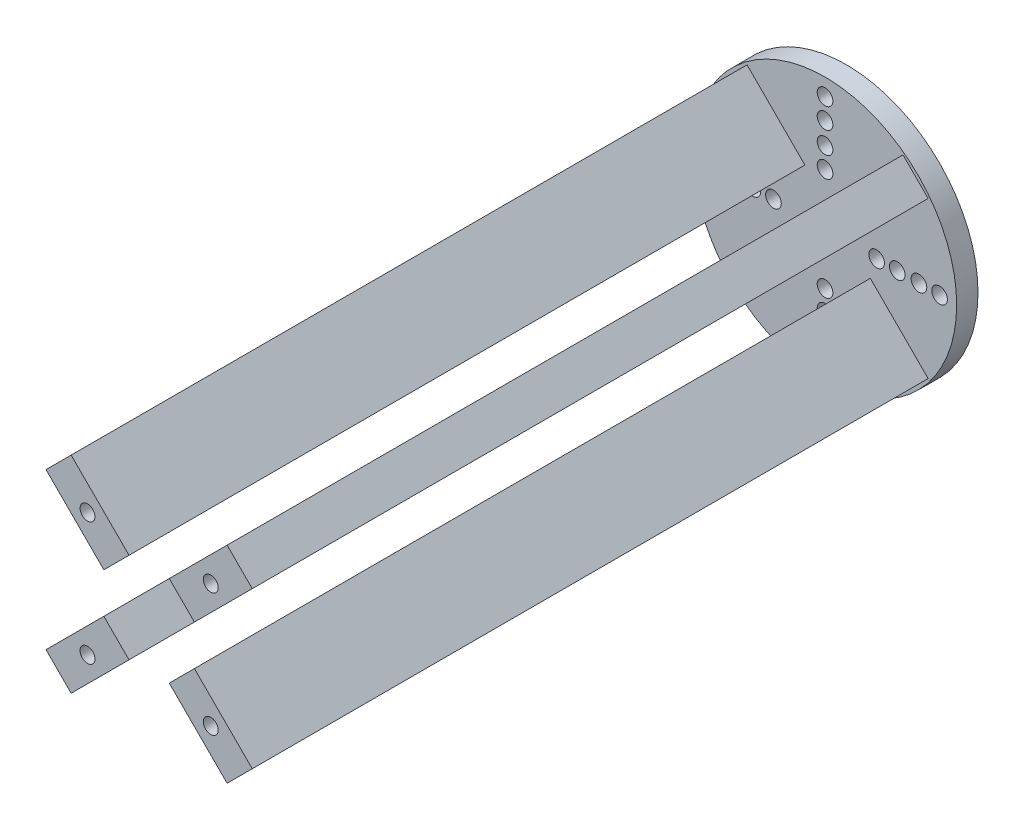
from build123d import *

# Parameters (mm, degrees)
AUFSATZ_LINEAR_AUSTRAGEN1_DEPTH = 3
AUFSATZ_LINEAR_AUSTRAGEN2_DEPTH = 95
SKIZZE5_R                       = 1.05
SCHNITT_LINEAR_AUSTRAGEN2_DEPTH = 13


with BuildPart() as part:
    # Skizze2 → Aufsatz-Linear austragen1 (new body)
    with BuildSketch(Plane.XY):
        with BuildLine():
            ThreePointArc((18.5, 0), (13.081475452, 13.081475452), (0, 18.5))
            Line((0, 18.5), (0, 17.2))
            ThreePointArc((0, 17.2), (0.777817459, 16.877817459), (1.1, 16.1))
            ThreePointArc((1.1, 16.1), (1.099839478, 16.081208438), (1.099357959, 16.06242236))
            ThreePointArc((1.099357959, 16.06242236), (0.764416312, 15.309008406), (0, 15))
            Line((0, 15), (0, 14.3))
            ThreePointArc((0, 14.3), (0.777817459, 13.977817459), (1.1, 13.2))
            ThreePointArc((1.1, 13.2), (1.099761155, 13.177078356), (1.099044724, 13.154166667))
            ThreePointArc((1.099044724, 13.154166667), (0.761440521, 12.40614338), (0, 12.1))
            Line((0, 12.1), (0, 11.25))
            ThreePointArc((0, 11.25), (0.777817459, 10.927817459), (1.1, 10.15))
            ThreePointArc((1.1, 10.15), (1.099595894, 10.120186092), (1.098383874, 10.090394089))
            ThreePointArc((1.098383874, 10.090394089), (0.756450097, 9.35138667), (0, 9.05))
            Line((0, 9.05), (0, 8.35))
            ThreePointArc((0, 8.35), (0.777817459, 8.027817459), (1.1, 7.25))
            ThreePointArc((1.1, 7.25), (1.099207253, 7.208245771), (1.096830153, 7.166551724))
            ThreePointArc((1.096830153, 7.166551724), (0.747732204, 6.443218399), (0, 6.15))
            Line((0, 6.15), (0, 0))
            Line((0, 0), (6.15, 0))
            ThreePointArc((6.15, 0), (6.443218399, 0.747732204), (7.166551724, 1.096830153))
            ThreePointArc((7.166551724, 1.096830153), (7.997732204, 0.806781601), (8.35, 0))
            Line((8.35, 0), (9.05, 0))
            ThreePointArc((9.05, 0), (9.35138667, 0.756450097), (10.090394089, 1.098383874))
            ThreePointArc((10.090394089, 1.098383874), (10.906450097, 0.79861333), (11.25, 0))
            Line((11.25, 0), (12.1, 0))
            ThreePointArc((12.1, 0), (12.40614338, 0.761440521), (13.154166667, 1.099044724))
            ThreePointArc((13.154166667, 1.099044724), (13.961440521, 0.79385662), (14.3, 0))
            Line((14.3, 0), (15, 0))
            ThreePointArc((15, 0), (15.309008406, 0.764416312), (16.06242236, 1.099357959))
            ThreePointArc((16.06242236, 1.099357959), (16.864416312, 0.790991594), (17.2, 0))
            Line((17.2, 0), (18.5, 0))
        make_face()
        with BuildLine():
            ThreePointArc((0, -18.5), (13.081475452, -13.081475452), (18.5, 0))
            Line((18.5, 0), (17.2, 0))
            ThreePointArc((17.2, 0), (16.864416312, -0.790991594), (16.06242236, -1.099357959))
            ThreePointArc((16.06242236, -1.099357959), (15.309008406, -0.764416312), (15, 0))
            Line((15, 0), (14.3, 0))
            ThreePointArc((14.3, 0), (13.961440521, -0.79385662), (13.154166667, -1.099044724))
            ThreePointArc((13.154166667, -1.099044724), (12.40614338, -0.761440521), (12.1, 0))
            Line((12.1, 0), (11.25, 0))
            ThreePointArc((11.25, 0), (10.906450097, -0.79861333), (10.090394089, -1.098383874))
            ThreePointArc((10.090394089, -1.098383874), (9.35138667, -0.756450097), (9.05, 0))
            Line((9.05, 0), (8.35, 0))
            ThreePointArc((8.35, 0), (7.997732204, -0.806781601), (7.166551724, -1.096830153))
            ThreePointArc((7.166551724, -1.096830153), (6.443218399, -0.747732204), (6.15, 0))
            Line((6.15, 0), (0, 0))
            Line((0, 0), (0, -6.15))
            ThreePointArc((0, -6.15), (0.747732204, -6.443218399), (1.096830153, -7.166551724))
            ThreePointArc((1.096830153, -7.166551724), (1.099207253, -7.208245771), (1.1, -7.25))
            ThreePointArc((1.1, -7.25), (0.777817459, -8.027817459), (0, -8.35))
            Line((0, -8.35), (0, -9.05))
            ThreePointArc((0, -9.05), (0.756450097, -9.35138667), (1.098383874, -10.090394089))
            ThreePointArc((1.098383874, -10.090394089), (1.099595894, -10.120186092), (1.1, -10.15))
            ThreePointArc((1.1, -10.15), (0.777817459, -10.927817459), (0, -11.25))
            Line((0, -11.25), (0, -12.1))
            ThreePointArc((0, -12.1), (0.761440521, -12.40614338), (1.099044724, -13.154166667))
            ThreePointArc((1.099044724, -13.154166667), (1.099761155, -13.177078356), (1.1, -13.2))
            ThreePointArc((1.1, -13.2), (0.777817459, -13.977817459), (0, -14.3))
            Line((0, -14.3), (0, -15))
            ThreePointArc((0, -15), (0.764416312, -15.309008406), (1.099357959, -16.06242236))
            ThreePointArc((1.099357959, -16.06242236), (1.099839478, -16.081208438), (1.1, -16.1))
            ThreePointArc((1.1, -16.1), (0.777817459, -16.877817459), (0, -17.2))
            Line((0, -17.2), (0, -18.5))
        make_face()
        with BuildLine():
            Line((-17.2, 0), (-18.5, 0))
            ThreePointArc((-18.5, 0), (-13.081475452, -13.081475452), (0, -18.5))
            Line((0, -18.5), (0, -17.2))
            ThreePointArc((0, -17.2), (-0.790991594, -16.864416312), (-1.099357959, -16.06242236))
            ThreePointArc((-1.099357959, -16.06242236), (-0.764416312, -15.309008406), (0, -15))
            Line((0, -15), (0, -14.3))
            ThreePointArc((0, -14.3), (-0.79385662, -13.961440521), (-1.099044724, -13.154166667))
            ThreePointArc((-1.099044724, -13.154166667), (-0.761440521, -12.40614338), (0, -12.1))
            Line((0, -12.1), (0, -11.25))
            ThreePointArc((0, -11.25), (-0.79861333, -10.906450097), (-1.098383874, -10.090394089))
            ThreePointArc((-1.098383874, -10.090394089), (-0.756450097, -9.35138667), (0, -9.05))
            Line((0, -9.05), (0, -8.35))
            ThreePointArc((0, -8.35), (-0.806781601, -7.997732204), (-1.096830153, -7.166551724))
            ThreePointArc((-1.096830153, -7.166551724), (-0.747732204, -6.443218399), (0, -6.15))
            Line((0, -6.15), (0, 0))
            Line((0, 0), (-6.15, 0))
            ThreePointArc((-6.15, 0), (-6.443218399, -0.747732204), (-7.166551724, -1.096830153))
            ThreePointArc((-7.166551724, -1.096830153), (-7.997732204, -0.806781601), (-8.35, 0))
            Line((-8.35, 0), (-9.05, 0))
            ThreePointArc((-9.05, 0), (-9.35138667, -0.756450097), (-10.090394089, -1.098383874))
            ThreePointArc((-10.090394089, -1.098383874), (-10.906450097, -0.79861333), (-11.25, 0))
            Line((-11.25, 0), (-12.1, 0))
            ThreePointArc((-12.1, 0), (-12.40614338, -0.761440521), (-13.154166667, -1.099044724))
            ThreePointArc((-13.154166667, -1.099044724), (-13.961440521, -0.79385662), (-14.3, 0))
            Line((-14.3, 0), (-15, 0))
            ThreePointArc((-15, 0), (-15.309008406, -0.764416312), (-16.06242236, -1.099357959))
            ThreePointArc((-16.06242236, -1.099357959), (-16.864416312, -0.790991594), (-17.2, 0))
        make_face()
        with BuildLine():
            Line((0, 17.2), (0, 18.5))
            ThreePointArc((0, 18.5), (-13.081475452, 13.081475452), (-18.5, 0))
            Line((-18.5, 0), (-17.2, 0))
            ThreePointArc((-17.2, 0), (-16.864416312, 0.790991594), (-16.06242236, 1.099357959))
            ThreePointArc((-16.06242236, 1.099357959), (-15.309008406, 0.764416312), (-15, 0))
            Line((-15, 0), (-14.3, 0))
            ThreePointArc((-14.3, 0), (-13.961440521, 0.79385662), (-13.154166667, 1.099044724))
            ThreePointArc((-13.154166667, 1.099044724), (-12.40614338, 0.761440521), (-12.1, 0))
            Line((-12.1, 0), (-11.25, 0))
            ThreePointArc((-11.25, 0), (-10.906450097, 0.79861333), (-10.090394089, 1.098383874))
            ThreePointArc((-10.090394089, 1.098383874), (-9.35138667, 0.756450097), (-9.05, 0))
            Line((-9.05, 0), (-8.35, 0))
            ThreePointArc((-8.35, 0), (-7.997732204, 0.806781601), (-7.166551724, 1.096830153))
            ThreePointArc((-7.166551724, 1.096830153), (-6.443218399, 0.747732204), (-6.15, 0))
            Line((-6.15, 0), (0, 0))
            Line((0, 0), (0, 6.15))
            ThreePointArc((0, 6.15), (-0.747732204, 6.443218399), (-1.096830153, 7.166551724))
            ThreePointArc((-1.096830153, 7.166551724), (-0.806781601, 7.997732204), (0, 8.35))
            Line((0, 8.35), (0, 9.05))
            ThreePointArc((0, 9.05), (-0.756450097, 9.35138667), (-1.098383874, 10.090394089))
            ThreePointArc((-1.098383874, 10.090394089), (-0.79861333, 10.906450097), (0, 11.25))
            Line((0, 11.25), (0, 12.1))
            ThreePointArc((0, 12.1), (-0.761440521, 12.40614338), (-1.099044724, 13.154166667))
            ThreePointArc((-1.099044724, 13.154166667), (-0.79385662, 13.961440521), (0, 14.3))
            Line((0, 14.3), (0, 15))
            ThreePointArc((0, 15), (-0.764416312, 15.309008406), (-1.099357959, 16.06242236))
            ThreePointArc((-1.099357959, 16.06242236), (-0.790991594, 16.864416312), (0, 17.2))
        make_face()
    extrude(amount=AUFSATZ_LINEAR_AUSTRAGEN1_DEPTH)

    # Skizze4 → Aufsatz-Linear austragen2 (add)
    with BuildSketch(Plane.XY.offset(3)):
        Polygon((2.828427125, 6.363961031), (10.960155108, 14.495689014), (14.495689014, 10.960155108), (6.363961031, 2.828427125), align=None)
        Polygon((6.363961031, -2.828427125), (14.495689014, -10.960155108), (10.960155108, -14.495689014), (2.828427125, -6.363961031), align=None)
        Polygon((-2.828427125, -6.363961031), (-10.960155108, -14.495689014), (-14.495689014, -10.960155108), (-6.363961031, -2.828427125), align=None)
        Polygon((-6.363961031, 2.828427125), (-14.495689014, 10.960155108), (-10.960155108, 14.495689014), (-2.828427125, 6.363961031), align=None)
    extrude(amount=AUFSATZ_LINEAR_AUSTRAGEN2_DEPTH)

    # Skizze5 → Schnitt-Linear austragen2 (cut)
    with BuildSketch(Plane.XY.offset(98)):
        with Locations((-8.66205807, -8.66205807)):
            Circle(SKIZZE5_R)
        with Locations((-8.66205807, 8.66205807)):
            Circle(SKIZZE5_R)
        with Locations((8.66205807, 8.66205807)):
            Circle(SKIZZE5_R)
        with Locations((8.66205807, -8.66205807)):
            Circle(SKIZZE5_R)
    extrude(amount=-SCHNITT_LINEAR_AUSTRAGEN2_DEPTH, mode=Mode.SUBTRACT)


solid = part.part
